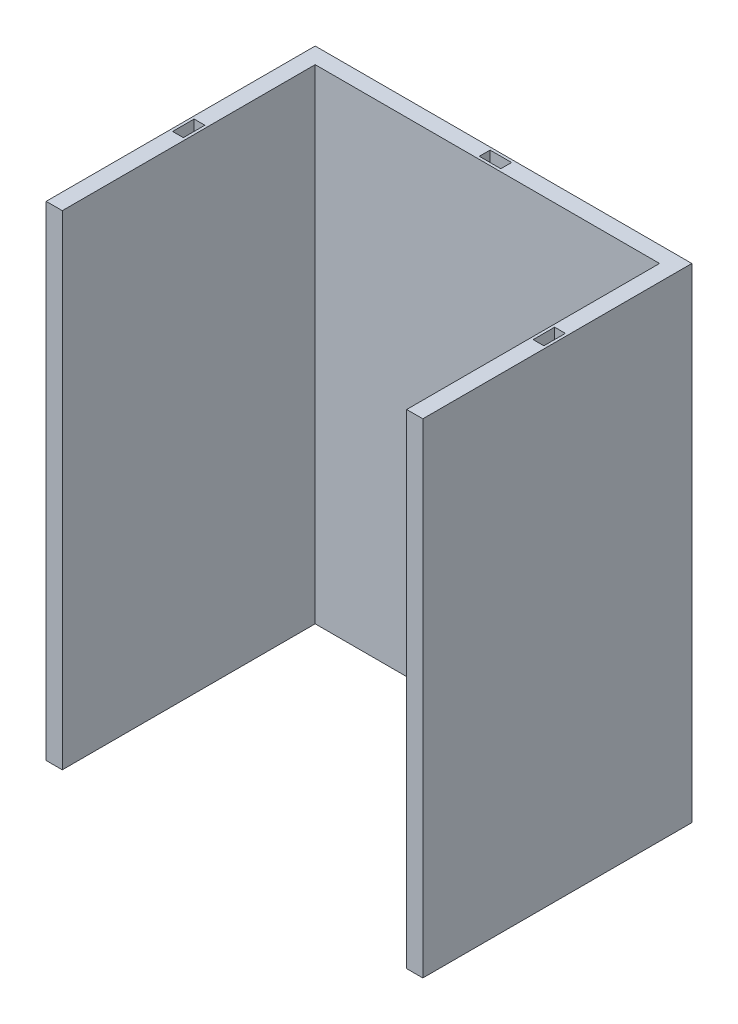
from build123d import *

# Parameters (mm, degrees)
BOSS_EXTRUDE1_DEPTH = 45
SKETCH2_W           = 2
SKETCH2_H           = 4
SKETCH2_W_2         = 4
SKETCH2_H_2         = 2
CUT_EXTRUDE1_DEPTH  = 3


with BuildPart() as part:
    # Sketch1 → Boss-Extrude1 (new, symmetric)
    with BuildSketch(Plane(origin=(0, 0, 0), x_dir=(1, 0, 0), z_dir=(0, 1, 0))):
        Polygon((-35, 0), (-35, 50), (35, 50), (35, 0), (32, 0), (32, 47), (-32, 47), (-32, 0), align=None)
    extrude(amount=BOSS_EXTRUDE1_DEPTH, both=True)

    # Sketch2 → Cut-Extrude1 (cut)
    with BuildSketch(Plane(origin=(0, 45, 0), x_dir=(1, 0, 0), z_dir=(0, 1, 0))):
        with Locations((33.5, 25)):
            Rectangle(SKETCH2_W, SKETCH2_H)
        with Locations((-33.5, 25)):
            Rectangle(SKETCH2_W, SKETCH2_H)
        with Locations((0, 48.5)):
            Rectangle(SKETCH2_W_2, SKETCH2_H_2)
    cut_extrude1 = extrude(amount=-CUT_EXTRUDE1_DEPTH, mode=Mode.SUBTRACT)

    # Mirror1: Cut-Extrude1 across plane
    add(cut_extrude1.mirror(Plane.ZX), mode=Mode.SUBTRACT)


solid = part.part
